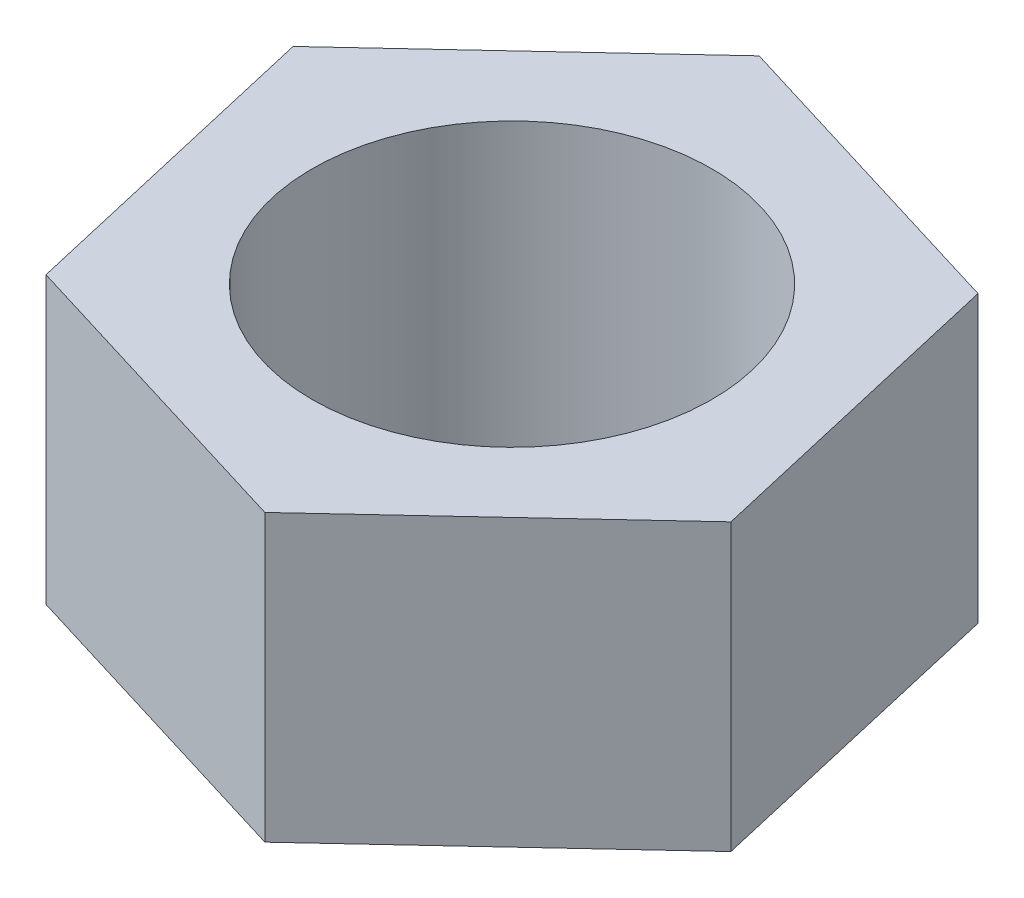
from build123d import *

# Parameters (mm, degrees)
SKETCH_1_R      = 7
EXTRUDE_1_DEPTH = 10


with BuildPart() as part:
    # Эскиз1 → Вытянуть1 (new body)
    with BuildSketch(Plane(origin=(0, 0, 0), x_dir=(1, 0, 0), z_dir=(0, 1, 0))):
        Polygon((2.596453934, -11.251300383), (11.042138924, -3.377055124), (8.44568499, 7.874245258), (-2.596453934, 11.251300383), (-11.042138924, 3.377055124), (-8.44568499, -7.874245258), align=None)
        with Locations(Location((0, 0, 0), (0, 0, 270))):
            Circle(SKETCH_1_R, mode=Mode.SUBTRACT)
    extrude(amount=EXTRUDE_1_DEPTH)


solid = part.part
